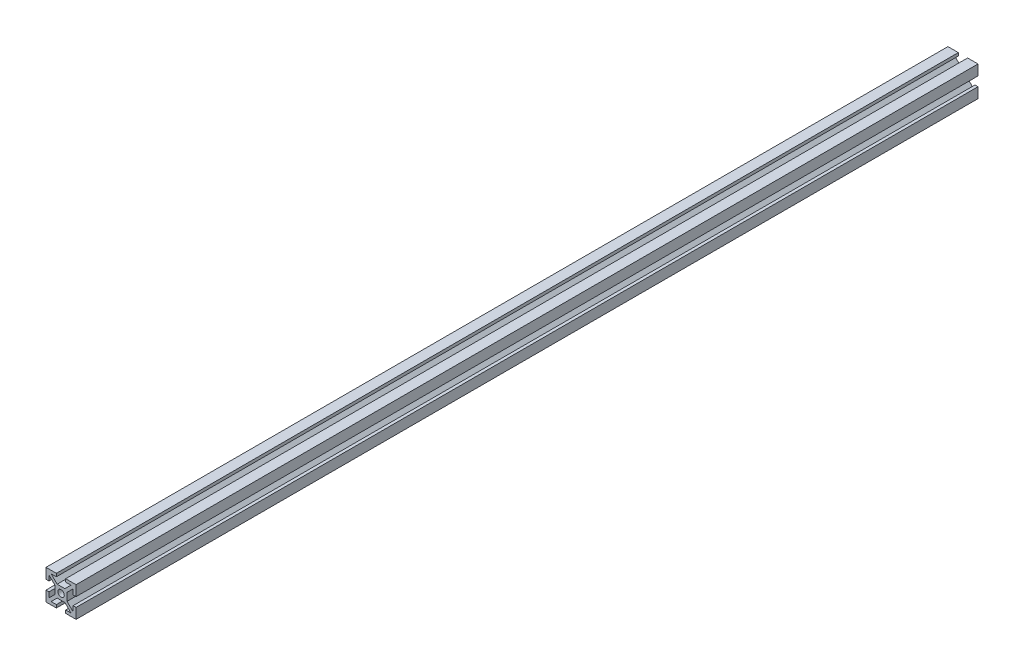
from build123d import *

# Parameters (mm, degrees)
ESQUISSE1_R        = 2.15
BOSS_EXTRU_1_DEPTH = 600


with BuildPart() as part:
    # Esquisse1 → Boss.-Extru.1 (new body)
    with BuildSketch(Plane.XY):
        Polygon((20, 13.1), (18, 13.1), (18, 16.585786438), (14, 12.585786438), (14, 10), (14, 7.414213562), (18, 3.414213562), (18, 6.9), (20, 6.9), (20, 0), (13.1, 0), (13.1, 2), (16.585786438, 2), (12.585786438, 6), (10, 6), (7.414213562, 6), (3.414213562, 2), (6.9, 2), (6.9, 0), (0, 0), (0, 6.9), (2, 6.9), (2, 3.414213562), (6, 7.414213562), (6, 10), (6, 12.585786438), (2, 16.585786438), (2, 13.1), (0, 13.1), (0, 20), (6.9, 20), (6.9, 18), (3.414213562, 18), (7.414213562, 14), (10, 14), (12.585786438, 14), (16.585786438, 18), (13.1, 18), (13.1, 20), (20, 20), align=None)
        with Locations((10, 10)):
            Circle(ESQUISSE1_R, mode=Mode.SUBTRACT)
    extrude(amount=BOSS_EXTRU_1_DEPTH)


solid = part.part
